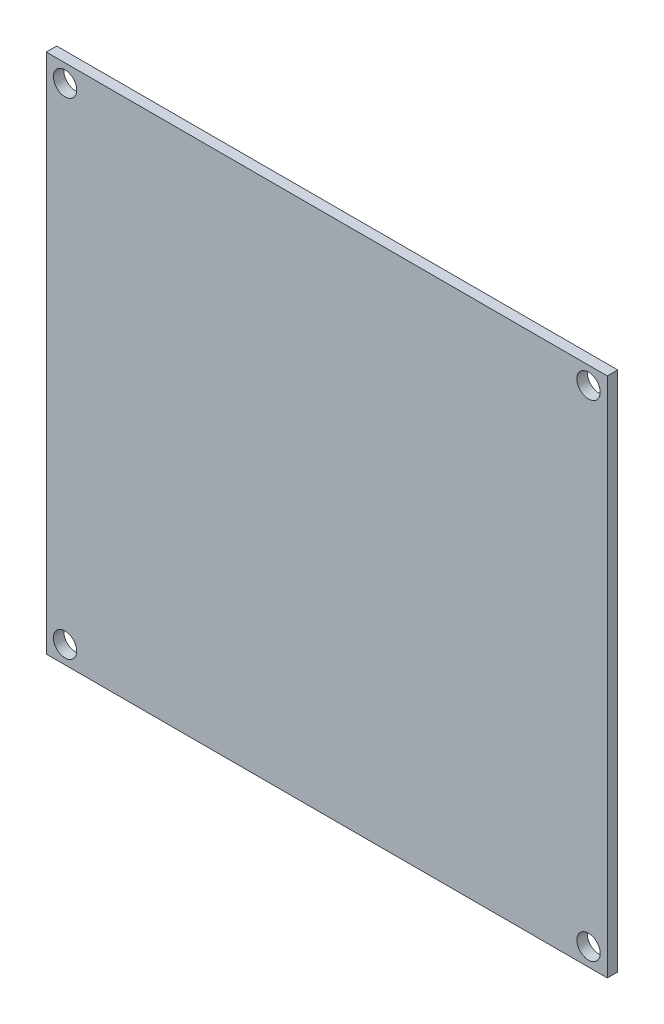
from build123d import *

# Parameters (mm, degrees)
SKETCH1_W             = 136.652
SKETCH1_H             = 127
BOSS_EXTRUDE1_DEPTH   = 2.54
SKETCH1_5_OUTSIDE_W   = 175.966
SKETCH1_5_OUTSIDE_H   = 166.314
SKETCH1_5_OUTSIDE_W_2 = 136.652
SKETCH1_5_OUTSIDE_H_2 = 127
SKETCH1_5_OUTSIDE_R   = 2.8448
CUT_EXTRUDE3_DEPTH    = 30.48


with BuildPart() as part:
    # Sketch1 → Boss-Extrude1 (new body)
    with BuildSketch(Plane.XY):
        Rectangle(SKETCH1_W, SKETCH1_H)
    extrude(amount=BOSS_EXTRUDE1_DEPTH)

    # Sketch1<5> outside → Cut-Extrude3 (cut)
    # profile 1 of 5: a face of its own
    with BuildSketch(Plane.XY):
        Rectangle(SKETCH1_5_OUTSIDE_W, SKETCH1_5_OUTSIDE_H)
        Rectangle(SKETCH1_5_OUTSIDE_W_2, SKETCH1_5_OUTSIDE_H_2, mode=Mode.SUBTRACT)
    # profile 2 of 5: a face of its own
    with BuildSketch(Plane.XY):
        with Locations((-63.754, 59.182)):
            Circle(SKETCH1_5_OUTSIDE_R)
    # profile 3 of 5: a face of its own
    with BuildSketch(Plane.XY):
        with Locations((63.754, 59.182)):
            Circle(SKETCH1_5_OUTSIDE_R)
    # profile 4 of 5: a face of its own
    with BuildSketch(Plane.XY):
        with Locations((63.754, -59.182)):
            Circle(SKETCH1_5_OUTSIDE_R)
    # profile 5 of 5: a face of its own
    with BuildSketch(Plane.XY):
        with Locations((-63.754, -59.182)):
            Circle(SKETCH1_5_OUTSIDE_R)
    extrude(amount=CUT_EXTRUDE3_DEPTH, mode=Mode.SUBTRACT)


solid = part.part
